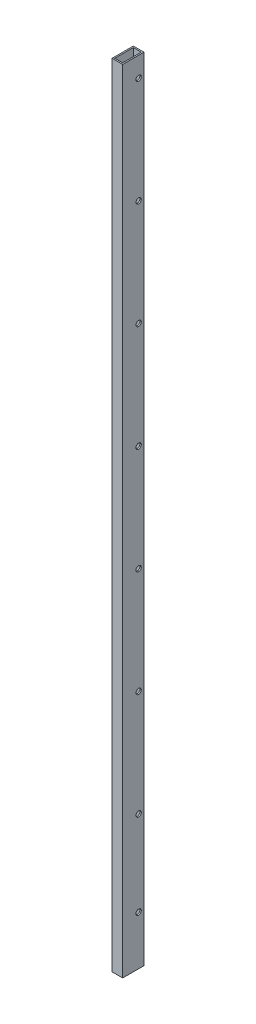
from build123d import *

# Parameters (mm, degrees)
SKETCH1_W           = 25.4
SKETCH1_H           = 50.8
SKETCH1_W_2         = 19.05
SKETCH1_H_2         = 44.45
BOSS_EXTRUDE2_DEPTH = 1892.3
SKETCH2_R           = 3.175
CUT_EXTRUDE1_DEPTH  = 25.4
SKETCH3_R           = 3.175
CUT_EXTRUDE2_DEPTH  = 25.4
SKETCH4_R           = 6.35
CUT_EXTRUDE3_DEPTH  = 3.175
SKETCH5_R           = 6.35
CUT_EXTRUDE4_DEPTH  = 3.175


with BuildPart() as part:
    # Sketch1 → Boss-Extrude2 (new body)
    with BuildSketch(Plane(origin=(0, 0, 0), x_dir=(1, 0, 0), z_dir=(0, 1, 0))):
        Rectangle(SKETCH1_W, SKETCH1_H)
        Rectangle(SKETCH1_W_2, SKETCH1_H_2, mode=Mode.SUBTRACT)
    extrude(amount=BOSS_EXTRUDE2_DEPTH)

    # Sketch2 → Cut-Extrude1 (cut)
    with BuildSketch(Plane(origin=(12.7, 0, 0), x_dir=(0, 0, -1), z_dir=(1, 0, 0))):
        with Locations((12.7, 1844.658598875)):
            Circle(SKETCH2_R)
        with Locations((12.7, 1590.658598875)):
            Circle(SKETCH2_R)
        with Locations((12.7, 1336.658598875)):
            Circle(SKETCH2_R)
        with Locations((12.7, 1082.658598875)):
            Circle(SKETCH2_R)
        with Locations((12.7, 828.658598875)):
            Circle(SKETCH2_R)
        with Locations((12.7, 574.658598875)):
            Circle(SKETCH2_R)
        with Locations((12.7, 320.658598875)):
            Circle(SKETCH2_R)
    extrude(amount=-CUT_EXTRUDE1_DEPTH, mode=Mode.SUBTRACT)

    # Sketch3 → Cut-Extrude2 (cut)
    with BuildSketch(Plane(origin=(12.7, 0, 0), x_dir=(0, 0, -1), z_dir=(1, 0, 0))):
        with Locations((12.7, 117.458598875)):
            Circle(SKETCH3_R)
    extrude(amount=-CUT_EXTRUDE2_DEPTH, mode=Mode.SUBTRACT)

    # Sketch4 → Cut-Extrude3 (cut)
    with BuildSketch(Plane(origin=(12.7, 0, 0), x_dir=(0, 0, -1), z_dir=(1, 0, 0))):
        with Locations((12.7, 1844.658598875)):
            Circle(SKETCH4_R)
        with Locations((12.7, 1590.658598875)):
            Circle(SKETCH4_R)
        with Locations((12.7, 1336.658598875)):
            Circle(SKETCH4_R)
        with Locations((12.699999999, 1082.658598875)):
            Circle(SKETCH4_R)
        with Locations((12.699999999, 828.658598875)):
            Circle(SKETCH4_R)
        with Locations((12.699999999, 574.658598875)):
            Circle(SKETCH4_R)
        with Locations((12.699999999, 320.658598875)):
            Circle(SKETCH4_R)
    extrude(amount=-CUT_EXTRUDE3_DEPTH, mode=Mode.SUBTRACT)

    # Sketch5 → Cut-Extrude4 (cut)
    with BuildSketch(Plane(origin=(12.7, 0, 0), x_dir=(0, 0, -1), z_dir=(1, 0, 0))):
        with Locations((12.7, 117.458598875)):
            Circle(SKETCH5_R)
    extrude(amount=-CUT_EXTRUDE4_DEPTH, mode=Mode.SUBTRACT)


solid = part.part
